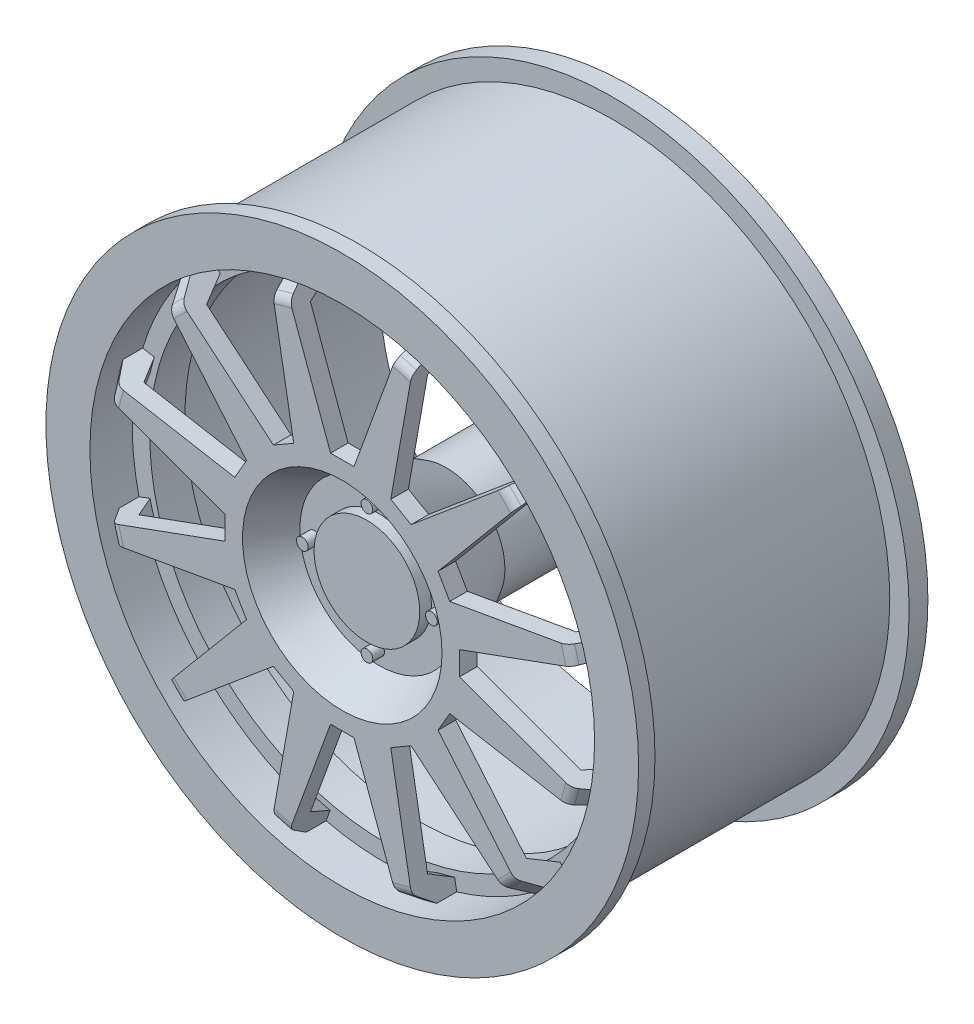
from build123d import *

# Parameters (mm, degrees)
SKETCH3_W           = 5.3
SKETCH3_H           = 3.6
CUT_EXTRUDE1_DEPTH  = 22.6
FILLET6_R           = 1
CUT_EXTRUDE6_START  = -3.6
CUT_EXTRUDE6_DEPTH  = 49.488361521
CIRPATTERN1_COUNT   = 12
SKETCH10_R          = 4.5
SKETCH10_R_2        = 0.5
BOSS_EXTRUDE1_DEPTH = 1


with BuildPart() as part:
    # Sketch1 → Revolve1 (revolve)
    with BuildSketch(Plane(origin=(0, 0, 0), x_dir=(0, 0, -1), z_dir=(1, 0, 0)), mode=Mode.PRIVATE) as revolve1_sk:
        Polygon((0, 25.25), (0, 21.5), (3.6, 21.5), (3.6, 20), (6.6, 20), (6.6, 21.5), (24.65, 21.5), (24.65, 25.25), (23.05, 25.25), (23.05, 23.6), (1.395283019, 23.6), (1.395283019, 25.25), align=None)
    revolve(revolve1_sk.sketch.rotate(Axis((0, 0, 0), (0, 0, -1)), 90), axis=Axis((0, 0, 0), (0, 0, -1)))



with BuildPart() as body_2:
    # Sketch2 → Revolve2 (revolve)
    with BuildSketch(Plane(origin=(0, 0, 0), x_dir=(0, 0, -1), z_dir=(1, 0, 0)), mode=Mode.PRIVATE) as revolve2_sk:
        Polygon((1.5, 0), (1.5, 9.25), (8.861215932, 5), (27.2, 5), (27.2, 0), align=None)
    revolve(revolve2_sk.sketch.rotate(Axis((0, 0, 0), (0, 0, -1)), 90), axis=Axis((0, 0, 0), (0, 0, -1)))

    # Sketch3 → Cut-Extrude1 (cut)
    with BuildSketch(Plane(origin=(0, 0, -27.2), x_dir=(-1, 0, 0), z_dir=(0, 0, -1))):
        Rectangle(SKETCH3_W, SKETCH3_H)
    extrude(amount=-CUT_EXTRUDE1_DEPTH, mode=Mode.SUBTRACT)


with BuildPart() as part_1:
    add(part.part)

    add(body_2.part)  # Revolve4 merges body 2
    # Sketch4 → Revolve4 (revolve)
    with BuildSketch(Plane(origin=(0, 0, 0), x_dir=(0, 0, -1), z_dir=(1, 0, 0)), mode=Mode.PRIVATE) as revolve4_sk:
        Polygon((3.6, 20.5), (3.6, 21.5), (1.915503322, 21.5), (0, 20), (0, 0), (1.5, 0), (1.5, 19.287564435), align=None)
    revolve(revolve4_sk.sketch.rotate(Axis((0, 0, 0), (0, 0, -1)), 90), axis=Axis((0, 0, 0), (0, 0, -1)))

    # Fillet6
    fillet6_edges = [part_1.edges().sort_by_distance(p)[0] for p in [
        (-20, 0, 0),
    ]]
    fillet(fillet6_edges, radius=FILLET6_R)

    # Sketch7 → Cut-Extrude6 (cut)
    with BuildSketch(Plane.XY.offset(CUT_EXTRUDE6_START)):
        with BuildLine():
            ThreePointArc((-4.288765415, 19.035808716), (-2.157613267, 19.393303671), (0, 19.512957804))
            Line((0, 19.512957804), (0, 21.5))
            ThreePointArc((0, 21.5), (-2.503741582, 21.353718133), (-4.973413212, 20.916863078))
            Line((-4.973413212, 20.916863078), (-4.288765415, 19.035808716))
        make_face()
        with BuildLine():
            Line((0, 21.5), (0, 19.512957804))
            ThreePointArc((0, 19.512957804), (2.157613267, 19.393303671), (4.288765415, 19.035808716))
            Line((4.288765415, 19.035808716), (4.973413212, 20.916863078))
            ThreePointArc((4.973413212, 20.916863078), (2.503741582, 21.353718133), (0, 21.5))
        make_face()
        with BuildLine():
            Line((0, 19.512957804), (0, 10))
            Line((0, 10), (1, 10))
            Line((1, 10), (4.288765415, 19.035808716))
            ThreePointArc((4.288765415, 19.035808716), (2.157613267, 19.393303671), (0, 19.512957804))
        make_face()
        with BuildLine():
            Line((-1, 10), (0, 10))
            Line((0, 10), (0, 19.512957804))
            ThreePointArc((0, 19.512957804), (-2.157613267, 19.393303671), (-4.288765415, 19.035808716))
            Line((-4.288765415, 19.035808716), (-1, 10))
        make_face()
    cut_extrude6 = extrude(amount=CUT_EXTRUDE6_DEPTH, mode=Mode.SUBTRACT)

    # CirPattern1: Cut-Extrude6 ×12 about axis
    cirpattern1_axis = Axis((0, 0, 0), (0, 0, 1))
    for i in range(1, CIRPATTERN1_COUNT):
        add(cut_extrude6.rotate(cirpattern1_axis, i * 360 / CIRPATTERN1_COUNT), mode=Mode.SUBTRACT)

    # Sketch9 → Cut-Revolve2 (revolve, cut)
    with BuildSketch(Plane(origin=(0, 0, 0), x_dir=(0, 0, -1), z_dir=(1, 0, 0)), mode=Mode.PRIVATE) as cut_revolve2_sk:
        Polygon((0, 0), (0, 8.5), (3.1, 6.710214166), (3.1, 0), align=None)
    revolve(cut_revolve2_sk.sketch.rotate(Axis((0, 0, 0), (0, 0, -1)), 90), axis=Axis((0, 0, 0), (0, 0, -1)), mode=Mode.SUBTRACT)

    # Sketch10 → Boss-Extrude1 (add)
    with BuildSketch(Plane.XY.offset(-3.1)):
        Circle(SKETCH10_R)
        with Locations((0, 5.5)):
            Circle(SKETCH10_R_2)
        with Locations((5.5, 0)):
            Circle(SKETCH10_R_2)
        with Locations((0, -5.5)):
            Circle(SKETCH10_R_2)
        with Locations((-5.5, 0)):
            Circle(SKETCH10_R_2)
    extrude(amount=BOSS_EXTRUDE1_DEPTH)


solid = part_1.part
